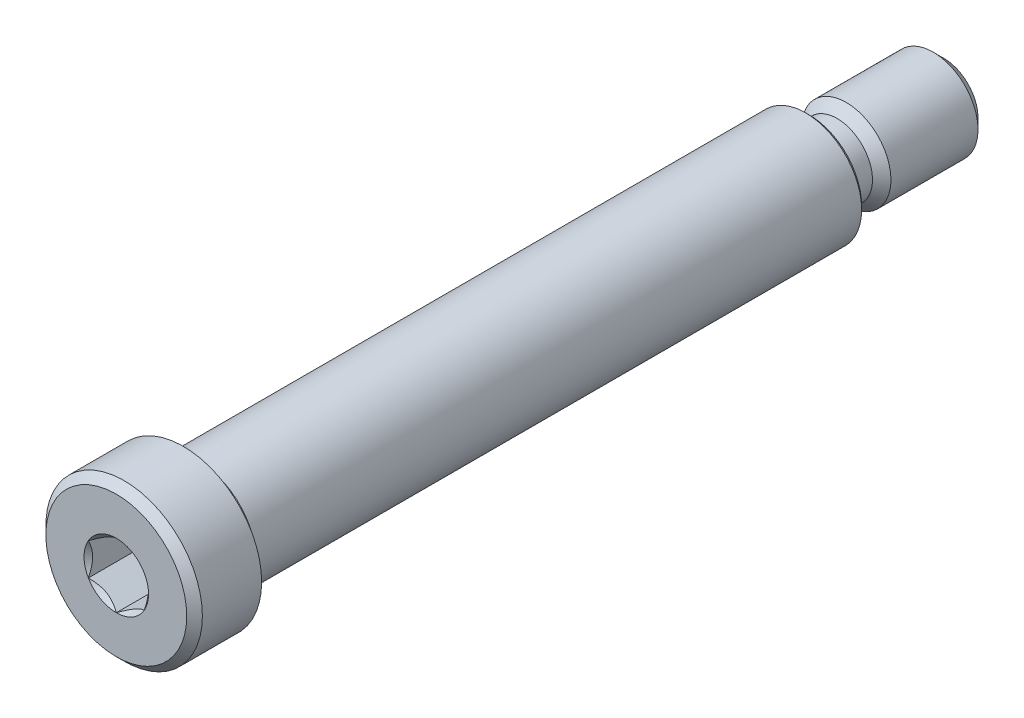
from build123d import *

# Parameters (mm, degrees)
CUT_EXTRUDE1_DEPTH = 7.14375


with BuildPart() as part:
    # Sketch4 → Revolve1 (revolve)
    with BuildSketch(Plane(origin=(0, 0, 0), x_dir=(0, 0, -1), z_dir=(1, 0, 0))):
        Polygon((-49.2125, 11.1125), (-57.62625, 11.1125), (-58.7375, 10.00125), (-58.7375, 0), (39.6875, 0), (39.6875, 7.408333333), (39.158333333, 7.9375), (-46.8503, 7.9375), (-47.247175, 7.540625), (-48.815625, 7.540625), (-49.2125, 7.9375), align=None)
    revolve(axis=Axis((0, 0, 58.7375), (0, 0, -1)))

    # Sketch5 → Cut-Extrude1 (cut)
    with BuildSketch(Plane.XY.offset(58.7375)):
        Polygon((3.96875, 2.291358881), (0, 4.582717762), (-3.96875, 2.291358881), (-3.96875, -2.291358881), (0, -4.582717762), (3.96875, -2.291358881), align=None)
    extrude(amount=-CUT_EXTRUDE1_DEPTH, mode=Mode.SUBTRACT)

    # Cut-Extrude4 cone 1 section (through the dimple's axis) → Cut-Extrude4 (revolve, cut)
    with BuildSketch(Plane(origin=(0, 0, 58.7375), x_dir=(0, -1, 0), z_dir=(1, 0, 0))):
        Polygon((0, 0), (4.582717762, 0), (0, 4.582717762), align=None)
    revolve(axis=Axis((0, 0, 58.7375), (0, 0, -1)), mode=Mode.SUBTRACT)

    # Sketch7 → Revolve2 (revolve)
    with BuildSketch(Plane(origin=(0, 0, 0), x_dir=(0, 0, -1), z_dir=(1, 0, 0))):
        Polygon((39.6875, 6.35), (57.272115385, 6.35), (58.7375, 4.884615385), (58.7375, 0), (39.6875, 0), align=None)
    revolve(axis=Axis((0, 0, -58.7375), (0, 0, 1)))

    # Sketch10 → Cut-Revolve1 (revolve, cut)
    with BuildSketch(Plane(origin=(0, 0, 0), x_dir=(0, 0, -1), z_dir=(1, 0, 0))):
        with BuildLine():
            Line((40.9956, 5.0419), (43.5991, 5.0419))
            Line((43.5991, 5.0419), (46.4947, 7.9375))
            Line((46.4947, 7.9375), (39.6875, 7.9375))
            Line((39.6875, 7.9375), (39.6875, 6.35))
            ThreePointArc((39.6875, 6.35), (40.07063362, 5.42503362), (40.9956, 5.0419))
        make_face()
    revolve(axis=Axis((0, 0, -58.7375), (0, 0, 1)), mode=Mode.SUBTRACT)


solid = part.part
